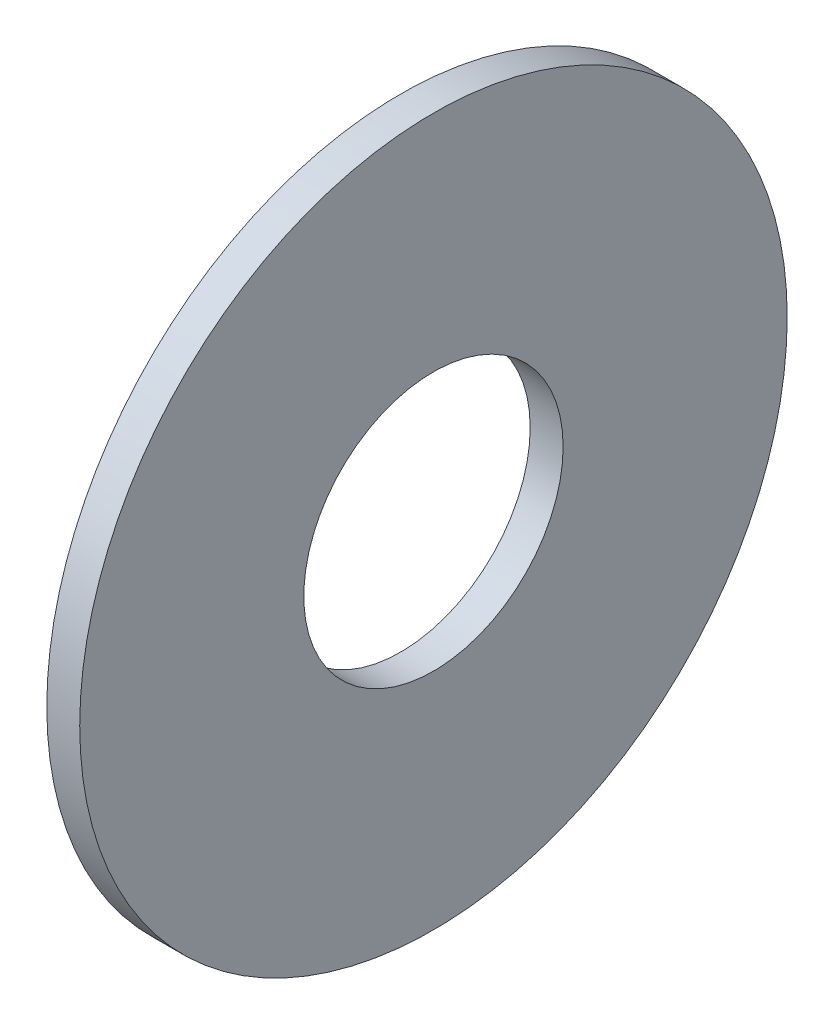
from build123d import *

# Parameters (mm, degrees)
SKETCH1_R      = 8.73125
SKETCH1_R_2    = 3.2004
EXTRUDE1_DEPTH = 0.8128


with BuildPart() as part:
    # Sketch1 → Extrude1 (new body)
    with BuildSketch(Plane(origin=(0, 0, 0), x_dir=(0, 0, -1), z_dir=(1, 0, 0))):
        Circle(SKETCH1_R)
        Circle(SKETCH1_R_2, mode=Mode.SUBTRACT)
    extrude(amount=EXTRUDE1_DEPTH)


solid = part.part
